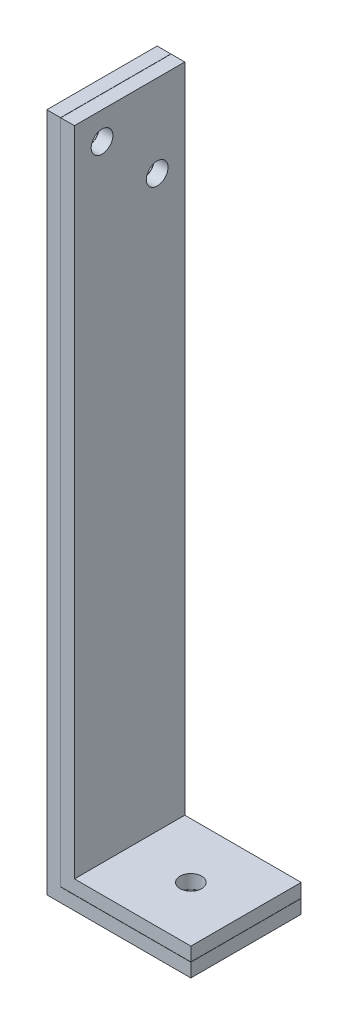
from build123d import *

# Parameters (mm, degrees)
SALIENTE_EXTRUIR1_DEPTH = 50.8
SALIENTE_EXTRUIR2_DEPTH = 50.8
CROQUIS3_R              = 5
CORTAR_EXTRUIR1_DEPTH   = 102.525
CROQUIS5_R              = 5
CORTAR_EXTRUIR2_DEPTH   = 24.525


with BuildPart() as part:
    # Croquis1 → Saliente-Extruir1 (new body)
    with BuildSketch(Plane.XY):
        Polygon((0, 0), (66.31, 0), (66.31, 6.31), (6.31, 6.31), (6.31, 313.04), (0, 313.04), align=None)
    extrude(amount=SALIENTE_EXTRUIR1_DEPTH)


with BuildPart() as body_2:
    # Croquis2 → Saliente-Extruir2 (new body)
    with BuildSketch(Plane.XY.offset(50.8)):
        Polygon((6.41, 313.04), (12.72, 313.04), (12.72, 12.72), (66.31, 12.72), (66.31, 6.41), (6.41, 6.41), align=None)
    extrude(amount=-SALIENTE_EXTRUIR2_DEPTH)


with BuildPart() as cortar_extruir1_tool:
    # Croquis3 → Cortar-Extruir1 (new body)
    with BuildSketch(Plane.ZY):
        with Locations(Location((12.7, 274.94, 0), (0, 0, 90))):
            Circle(CROQUIS3_R)
        with Locations(Location((38.1, 300.34, 0), (0, 0, 90))):
            Circle(CROQUIS3_R)
    extrude(amount=-CORTAR_EXTRUIR1_DEPTH)


with BuildPart() as part_1:
    add(part.part)

    # Cortar-Extruir1: cut by cortar_extruir1_tool
    add(cortar_extruir1_tool.part, mode=Mode.SUBTRACT)


with BuildPart() as body_2_1:
    add(body_2.part)

    # Cortar-Extruir1: cut by cortar_extruir1_tool
    add(cortar_extruir1_tool.part, mode=Mode.SUBTRACT)


with BuildPart() as cortar_extruir2_tool:
    # Croquis5 → Cortar-Extruir2 (new body)
    with BuildSketch(Plane(origin=(0, 12.72, 0), x_dir=(1, 0, 0), z_dir=(0, 1, 0))):
        with Locations(Location((40.91, -25.4, 0), (0, 0, 180))):
            Circle(CROQUIS5_R)
    extrude(amount=-CORTAR_EXTRUIR2_DEPTH)


with BuildPart() as part_2:
    add(part_1.part)

    # Cortar-Extruir2: cut by cortar_extruir2_tool
    add(cortar_extruir2_tool.part, mode=Mode.SUBTRACT)


with BuildPart() as body_2_2:
    add(body_2_1.part)

    # Cortar-Extruir2: cut by cortar_extruir2_tool
    add(cortar_extruir2_tool.part, mode=Mode.SUBTRACT)


solid = Compound([part_2.part, body_2_2.part])
